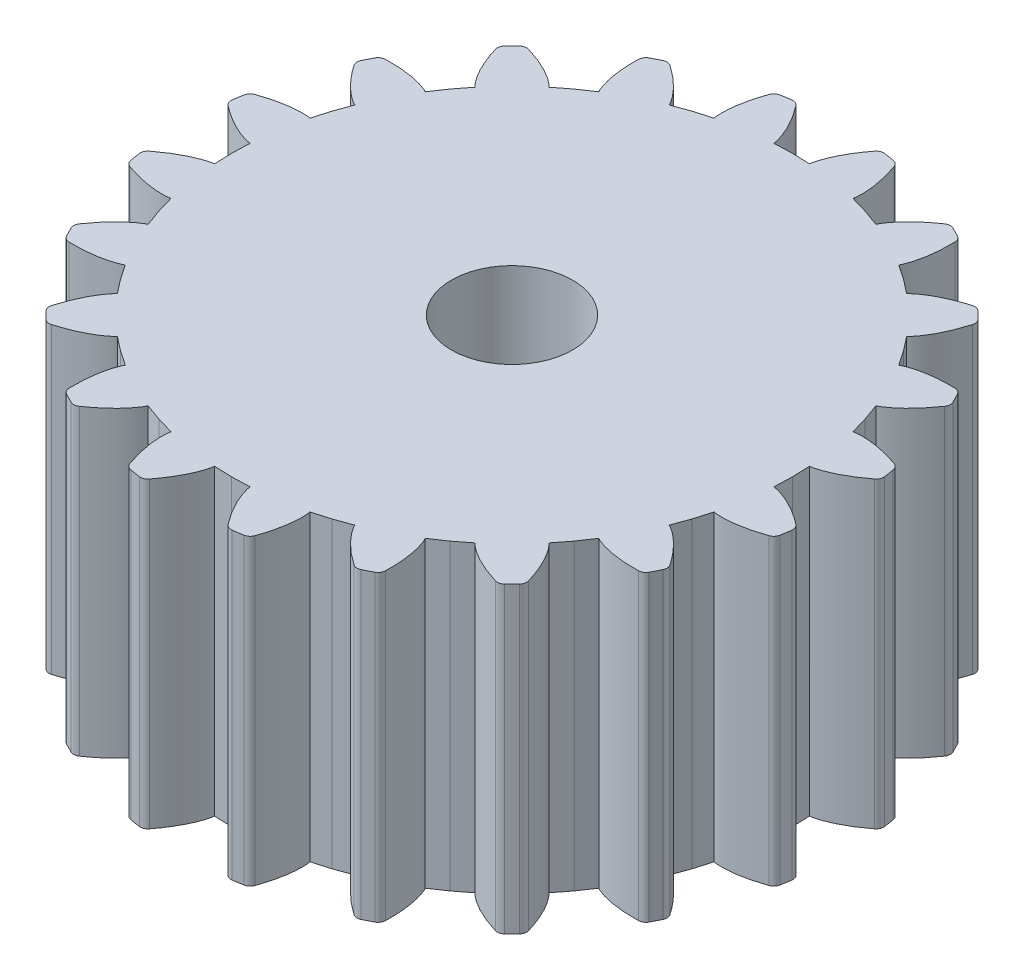
from build123d import *

# Parameters (mm, degrees)
SKETCH1_R                = 11.049
BOSS_EXTRUDE1_DEPTH      = 10.16
SKETCH2_R                = 2.032
CUT_EXTRUDE1_DEPTH       = 19.638304698
CUT_EXTRUDE2_DEPTH       = 19.638304698
FILLET1_R                = 0.254
CIRPATTERN1_COUNT        = 20
FILLET1_OF_CIRPATTERN1_R = 0.254


with BuildPart() as part:
    # Sketch1 → Boss-Extrude1 (new body)
    with BuildSketch(Plane(origin=(0, 0, 0), x_dir=(1, 0, 0), z_dir=(0, 1, 0))):
        with Locations(Location((0, 0, 0), (0, 0, 270))):
            Circle(SKETCH1_R)
    extrude(amount=BOSS_EXTRUDE1_DEPTH)

    # Sketch2 → Cut-Extrude1 (cut, through all)
    with BuildSketch(Plane(origin=(0, 10.16, 0), x_dir=(1, 0, 0), z_dir=(0, 1, 0))):
        with Locations(Location((0, 0, 0), (0, 0, 270))):
            Circle(SKETCH2_R)
    extrude(amount=-CUT_EXTRUDE1_DEPTH, mode=Mode.SUBTRACT)

    # Sketch3 → Cut-Extrude2 (cut, through all)
    with BuildSketch(Plane(origin=(0, 10.16, 0), x_dir=(1, 0, 0), z_dir=(0, 1, 0))):
        with BuildLine():
            ThreePointArc((9.37790635, 0.597573963), (9.388596831, 0.298808625), (9.398, 0))
            ThreePointArc((9.398, 0), (9.388596831, -0.298808625), (9.37790635, -0.597573963))
            add(Edge.make_bspline(
                [(9.37790635, -0.597573963), (9.380471536, -0.597770606), (9.387658561, -0.598424431), (9.409803044, -0.601103446), (9.453306116, -0.608242454), (9.506707718, -0.619712557), (9.567764638, -0.635431692), (9.626369528, -0.65258844), (9.676264138, -0.668486032), (9.725825082, -0.685485163), (9.774995933, -0.703445725), (9.834306893, -0.726411266), (9.905068354, -0.75562835), (9.987217313, -0.792213867), (10.079695834, -0.83657299), (10.173156264, -0.884828404), (10.264454042, -0.934809139), (10.355880878, -0.98815936), (10.443758564, -1.041797828), (10.534140036, -1.100406681), (10.617114626, -1.155980299), (10.709028715, -1.22142013), (10.78290283, -1.275160796), (10.858304769, -1.33330547), (10.894867438, -1.36199207), (10.913495279, -1.376815454)],
                knots=[0, 0, 0, 0, 0, 0.005376749, 0.015083688, 0.04661014, 0.092110526, 0.119476176, 0.146842496, 0.174208854, 0.201574956, 0.228941013, 0.256307345, 0.307035032, 0.361767352, 0.416499661, 0.471231937, 0.525964282, 0.580696616, 0.635428982, 0.690161387, 0.744893688, 0.799626082, 0.854358407, 0.909090915, 0.909090915, 0.909090915, 0.909090915, 0.909090915], degree=4))
            ThreePointArc((10.913495279, -1.376815454), (10.976407887, -1.423959029), (11.036474999, -1.474678405))
            ThreePointArc((11.036474999, -1.474678405), (11.373955775, 0), (11.036474999, 1.474678405))
            ThreePointArc((11.036474999, 1.474678405), (10.976407887, 1.423959029), (10.913495279, 1.376815454))
            add(Edge.make_bspline(
                [(9.37790635, 0.597573963), (9.380471536, 0.597770606), (9.387658561, 0.598424431), (9.409803044, 0.601103446), (9.453306116, 0.608242454), (9.506707718, 0.619712557), (9.567764638, 0.635431692), (9.626369528, 0.65258844), (9.676264138, 0.668486032), (9.725825082, 0.685485163), (9.774995933, 0.703445725), (9.834306893, 0.726411266), (9.905068354, 0.75562835), (9.987217313, 0.792213867), (10.079695834, 0.83657299), (10.173156264, 0.884828404), (10.264454042, 0.934809139), (10.355880878, 0.98815936), (10.443758564, 1.041797828), (10.534140036, 1.100406681), (10.617114626, 1.155980299), (10.709028715, 1.22142013), (10.78290283, 1.275160796), (10.858304769, 1.33330547), (10.894867438, 1.36199207), (10.913495279, 1.376815454)],
                knots=[0, 0, 0, 0, 0, 0.005376749, 0.015083688, 0.04661014, 0.092110526, 0.119476176, 0.146842496, 0.174208854, 0.201574956, 0.228941013, 0.256307345, 0.307035032, 0.361767352, 0.416499661, 0.471231937, 0.525964282, 0.580696616, 0.635428982, 0.690161387, 0.744893688, 0.799626082, 0.854358407, 0.909090915, 0.909090915, 0.909090915, 0.909090915, 0.909090915], degree=4))
        make_face()
    cut_extrude2 = extrude(amount=-CUT_EXTRUDE2_DEPTH, mode=Mode.SUBTRACT)

    # Fillet1
    fillet1_edges = [part.edges().sort_by_distance(p)[0] for p in [
        (10.958654118, 5.08, 1.410071246),
        (10.958654118, 5.08, -1.410071246),
    ]]
    fillet(fillet1_edges, radius=FILLET1_R)

    # CirPattern1: Cut-Extrude2 ×20 about axis
    cirpattern1_axis = Axis((0, 10.16, 0), (0, 1, 0))
    for i in range(1, CIRPATTERN1_COUNT):
        add(cut_extrude2.rotate(cirpattern1_axis, i * 360 / CIRPATTERN1_COUNT), mode=Mode.SUBTRACT)

    # Fillet1 of CirPattern1
    fillet1_of_cirpattern1_edges = [part.edges().sort_by_distance(p)[0] for p in [
        (10.858035387, 5.08, -2.045352911),
        (9.986563431, 5.08, -4.727467805),
        (9.6945565, 5.08, -5.300563675),
        (8.036918334, 5.08, -7.582106877),
        (7.582106877, 5.08, -8.036918334),
        (5.300563675, 5.08, -9.6945565),
        (4.727467805, 5.08, -9.986563431),
        (2.045352911, 5.08, -10.858035387),
        (1.410071246, 5.08, -10.958654118),
        (-1.410071246, 5.08, -10.958654118),
        (-2.045352911, 5.08, -10.858035387),
        (-4.727467805, 5.08, -9.986563431),
        (-5.300563675, 5.08, -9.6945565),
        (-7.582106877, 5.08, -8.036918334),
        (-8.036918334, 5.08, -7.582106877),
        (-9.6945565, 5.08, -5.300563675),
        (-9.986563431, 5.08, -4.727467805),
        (-10.858035387, 5.08, -2.045352911),
        (-10.958654118, 5.08, -1.410071246),
        (-10.958654118, 5.08, 1.410071246),
        (-10.858035387, 5.08, 2.045352911),
        (-9.986563431, 5.08, 4.727467805),
        (-9.6945565, 5.08, 5.300563675),
        (-8.036918334, 5.08, 7.582106877),
        (-7.582106877, 5.08, 8.036918334),
        (-5.300563675, 5.08, 9.6945565),
        (-4.727467805, 5.08, 9.986563431),
        (-2.045352911, 5.08, 10.858035387),
        (-1.410071246, 5.08, 10.958654118),
        (1.410071246, 5.08, 10.958654118),
        (2.045352911, 5.08, 10.858035387),
        (4.727467805, 5.08, 9.986563431),
        (5.300563675, 5.08, 9.6945565),
        (7.582106877, 5.08, 8.036918334),
        (8.036918334, 5.08, 7.582106877),
        (9.6945565, 5.08, 5.300563675),
        (9.986563431, 5.08, 4.727467805),
        (10.858035387, 5.08, 2.045352911),
    ]]
    fillet(fillet1_of_cirpattern1_edges, radius=FILLET1_OF_CIRPATTERN1_R)


solid = part.part
